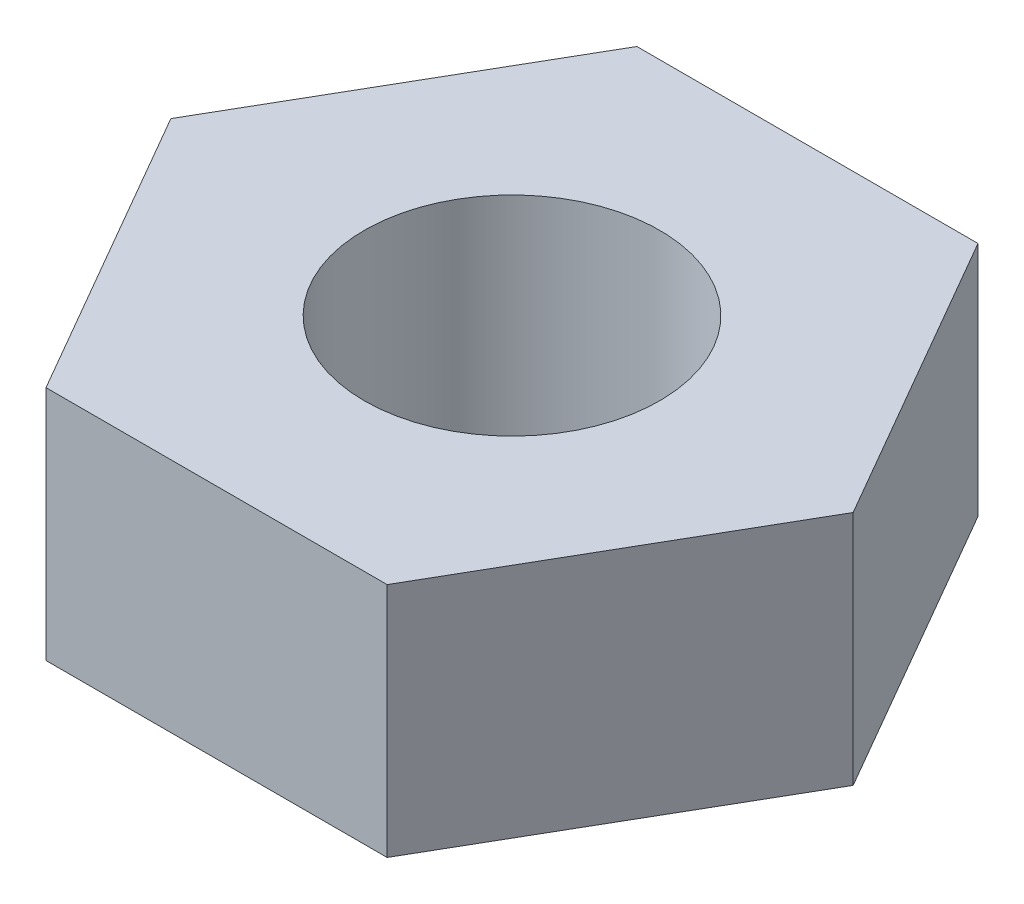
from build123d import *

# Parameters (mm, degrees)
SKETCH_1_R      = 1
EXTRUDE_1_DEPTH = 1.6


with BuildPart() as part:
    # 草图1 → 凸台-拉伸1 (new body)
    with BuildSketch(Plane(origin=(0, 0, 0), x_dir=(1, 0, 0), z_dir=(0, 1, 0))):
        Polygon((1.154700538, -2), (2.309401077, 0), (1.154700538, 2), (-1.154700538, 2), (-2.309401077, 0), (-1.154700538, -2), align=None)
        with Locations(Location((0, 0, 0), (0, 0, 270))):
            Circle(SKETCH_1_R, mode=Mode.SUBTRACT)
    extrude(amount=EXTRUDE_1_DEPTH)


solid = part.part
